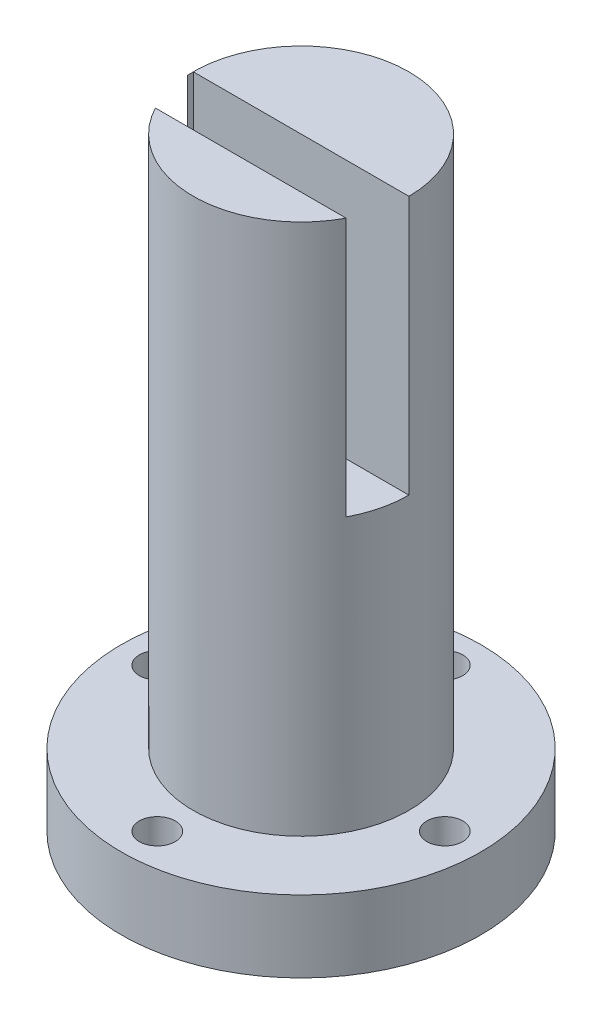
from build123d import *

# Parameters (mm, degrees)
SKETCH1_R           = 15
BOSS_EXTRUDE1_DEPTH = 44
SKETCH2_W           = 29.978808487
SKETCH2_H           = 7
CUT_EXTRUDE1_DEPTH  = 36
BOSS_EXTRUDE2_START = 30
SKETCH4_R           = 15
BOSS_EXTRUDE2_DEPTH = 30
SKETCH5_R           = 25
BOSS_EXTRUDE3_DEPTH = 10
SKETCH6_R           = 2.5
CUT_EXTRUDE2_DEPTH  = 92.137259121


with BuildPart() as part:
    # Sketch1 → Boss-Extrude1 (new body)
    with BuildSketch(Plane(origin=(0, 0, 0), x_dir=(1, 0, 0), z_dir=(0, 1, 0))):
        with Locations(Location((0, 0, 0), (0, 0, 270))):
            Circle(SKETCH1_R)
    extrude(amount=BOSS_EXTRUDE1_DEPTH)

    # Sketch2 → Cut-Extrude1 (cut)
    with BuildSketch(Plane(origin=(0, 44, 0), x_dir=(1, 0, 0), z_dir=(0, 1, 0))):
        with Locations((0.010595757, -3.5)):
            Rectangle(SKETCH2_W, SKETCH2_H)
    extrude(amount=-CUT_EXTRUDE1_DEPTH, mode=Mode.SUBTRACT)

    # Sketch4 → Boss-Extrude2 (add)
    with BuildSketch(Plane.XZ.offset(BOSS_EXTRUDE2_START)):
        with Locations(Location((0, 0, 0), (0, 0, 270))):
            Circle(SKETCH4_R)
    extrude(amount=-BOSS_EXTRUDE2_DEPTH)

    # Sketch5 → Boss-Extrude3 (add)
    with BuildSketch(Plane.XZ.offset(30)):
        with Locations(Location((0, 0, 0), (0, 0, 270))):
            Circle(SKETCH5_R)
    extrude(amount=BOSS_EXTRUDE3_DEPTH)

    # Sketch6 → Cut-Extrude2 (cut, through all)
    with BuildSketch(Plane.XZ.offset(40)):
        with BuildLine():
            ThreePointArc((0, 22.5), (-2.5, 20), (0, 17.5))
            Line((0, 17.5), (0, 22.5))
        make_face()
        with BuildLine():
            Line((0, 22.5), (0, 17.5))
            ThreePointArc((0, 17.5), (1.767766953, 18.232233047), (2.5, 20))
            ThreePointArc((2.5, 20), (1.767766953, 21.767766953), (0, 22.5))
        make_face()
        with Locations(Location((20, 0, 0), (0, 0, 270))):
            Circle(SKETCH6_R)
        with Locations(Location((0, -20, 0), (0, 0, 270))):
            Circle(SKETCH6_R)
        with Locations(Location((-20, 0, 0), (0, 0, 270))):
            Circle(SKETCH6_R)
    extrude(amount=-CUT_EXTRUDE2_DEPTH, mode=Mode.SUBTRACT)


solid = part.part
